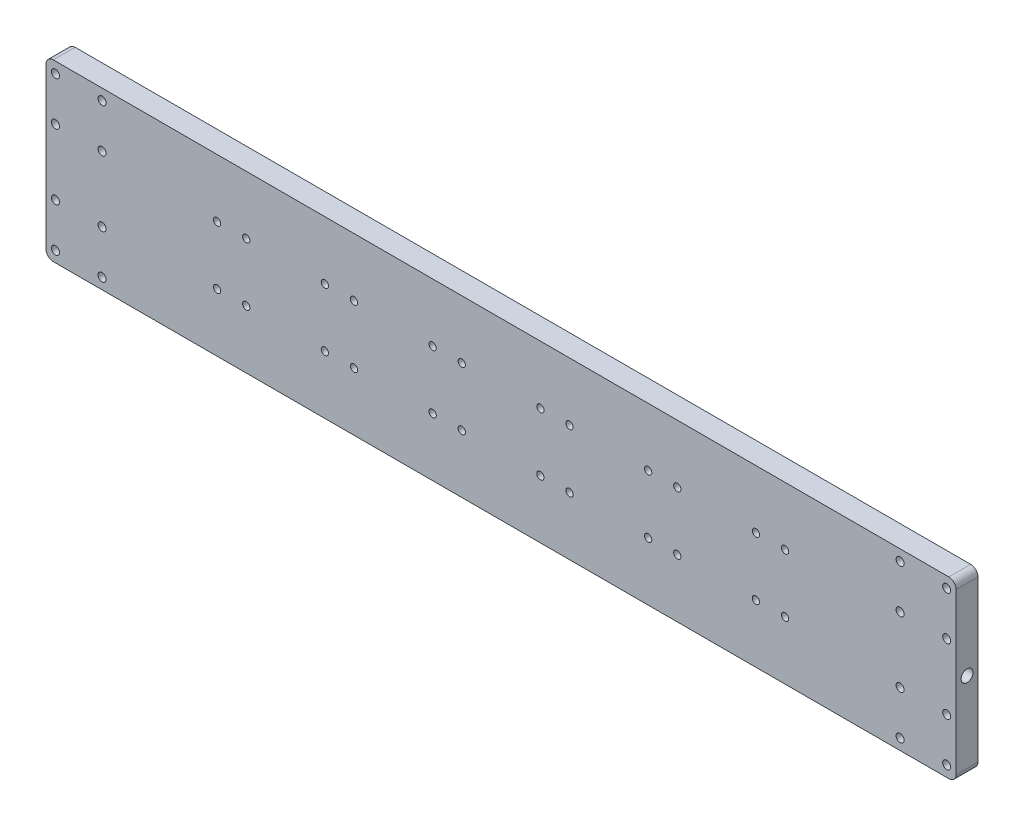
from build123d import *

# Parameters (mm, degrees)
ESQUISSE1_W                  = 625
ESQUISSE1_H                  = 120
BOSS_EXTRU_1_DEPTH           = 15
ENL_V_MAT_EXTRU_1_DEPTH      = 637.592491316
ENL_V_MAT_EXTRU_1_DEPTH_BACK = 637.592491316
ESQUISSE2_R                  = 2.75
CONG_1_R                     = 5
ESQUISSE3_R                  = 4.1
ENL_V_MAT_EXTRU_2_DEPTH      = 20
ENL_V_START                  = -605
ESQUISSE3_2_R                = 4.1
ENL_V_MAT_EXTRU_3_DEPTH      = 20
ENL_V_MAT_EXTRU_4_DEPTH      = 637.592491316
ENL_V_MAT_EXTRU_4_DEPTH_BACK = 637.592491316
ESQUISSE4_R                  = 2.5


with BuildPart() as part:
    # Esquisse1 → Boss.-Extru.1 (new body)
    with BuildSketch(Plane.XY):
        with Locations((312.5, 60)):
            Rectangle(ESQUISSE1_W, ESQUISSE1_H)
    extrude(amount=BOSS_EXTRU_1_DEPTH)

    # Esquisse2 → Enlèv. mat.-Extru.1 (cut, two sides: drawn at the far end of the back side and taken through both)
    with BuildSketch(Plane.XY.offset(15).offset(-ENL_V_MAT_EXTRU_1_DEPTH_BACK)):
        with Locations((6.5, 112.5)):
            Circle(ESQUISSE2_R)
        with Locations((6.5, 82.5)):
            Circle(ESQUISSE2_R)
        with Locations(Location((38.5, 82.5, 0), (0, 0, 180))):
            Circle(ESQUISSE2_R)
        with Locations(Location((38.5, 112.5, 0), (0, 0, 180))):
            Circle(ESQUISSE2_R)
        with Locations((38.5, 7.5)):
            Circle(ESQUISSE2_R)
        with Locations((38.5, 37.5)):
            Circle(ESQUISSE2_R)
        with Locations(Location((6.5, 37.5, 0), (0, 0, 180))):
            Circle(ESQUISSE2_R)
        with Locations(Location((6.5, 7.5, 0), (0, 0, 180))):
            Circle(ESQUISSE2_R)
        with Locations((618.5, 7.5)):
            Circle(ESQUISSE2_R)
        with Locations((618.5, 37.5)):
            Circle(ESQUISSE2_R)
        with Locations(Location((586.5, 37.5, 0), (0, 0, 180))):
            Circle(ESQUISSE2_R)
        with Locations(Location((586.5, 7.5, 0), (0, 0, 180))):
            Circle(ESQUISSE2_R)
        with Locations((586.5, 112.5)):
            Circle(ESQUISSE2_R)
        with Locations((586.5, 82.5)):
            Circle(ESQUISSE2_R)
        with Locations(Location((618.5, 82.5, 0), (0, 0, 180))):
            Circle(ESQUISSE2_R)
        with Locations(Location((618.5, 112.5, 0), (0, 0, 180))):
            Circle(ESQUISSE2_R)
    extrude(amount=ENL_V_MAT_EXTRU_1_DEPTH + ENL_V_MAT_EXTRU_1_DEPTH_BACK, mode=Mode.SUBTRACT)

    # Congé1
    cong_1_edges = [part.edges().sort_by_distance(p)[0] for p in [
        (0, 120, 7.5),
        (625, 120, 7.5),
        (625, 0, 7.5),
        (0, 0, 7.5),
    ]]
    fillet(cong_1_edges, radius=CONG_1_R)

    # Esquisse3 → Enlèv. mat.-Extru.2 (cut)
    with BuildSketch(Plane(origin=(625, 0, 0), x_dir=(0, 0, -1), z_dir=(1, 0, 0))):
        with Locations((-7.5, 60)):
            Circle(ESQUISSE3_R)
    extrude(amount=-ENL_V_MAT_EXTRU_2_DEPTH, mode=Mode.SUBTRACT)

    # Esquisse3<2> → Enlèv. mat.-Extru.3 (cut)
    with BuildSketch(Plane(origin=(625, 0, 0), x_dir=(0, 0, -1), z_dir=(1, 0, 0)).offset(ENL_V_START)):
        with Locations((-7.5, 60)):
            Circle(ESQUISSE3_2_R)
    extrude(amount=-ENL_V_MAT_EXTRU_3_DEPTH, mode=Mode.SUBTRACT)

    # Esquisse4 → Enlèv. mat.-Extru.4 (cut, two sides: drawn at the far end of the back side and taken through both)
    with BuildSketch(Plane.XY.offset(15).offset(-ENL_V_MAT_EXTRU_4_DEPTH_BACK)):
        with Locations((265.5, 80)):
            Circle(ESQUISSE4_R)
        with Locations(Location((285.5, 80, 0), (0, 0, 180))):
            Circle(ESQUISSE4_R)
        with Locations((285.5, 40)):
            Circle(ESQUISSE4_R)
        with Locations(Location((265.5, 40, 0), (0, 0, 180))):
            Circle(ESQUISSE4_R)
        with Locations((359.5, 40)):
            Circle(ESQUISSE4_R)
        with Locations(Location((339.5, 40, 0), (0, 0, 180))):
            Circle(ESQUISSE4_R)
        with Locations((339.5, 80)):
            Circle(ESQUISSE4_R)
        with Locations(Location((359.5, 80, 0), (0, 0, 180))):
            Circle(ESQUISSE4_R)
        with Locations((211.5, 40)):
            Circle(ESQUISSE4_R)
        with Locations(Location((191.5, 40, 0), (0, 0, 180))):
            Circle(ESQUISSE4_R)
        with Locations((191.5, 80)):
            Circle(ESQUISSE4_R)
        with Locations(Location((211.5, 80, 0), (0, 0, 180))):
            Circle(ESQUISSE4_R)
        with Locations((117.5, 80)):
            Circle(ESQUISSE4_R)
        with Locations(Location((137.5, 80, 0), (0, 0, 180))):
            Circle(ESQUISSE4_R)
        with Locations((137.5, 40)):
            Circle(ESQUISSE4_R)
        with Locations(Location((117.5, 40, 0), (0, 0, 180))):
            Circle(ESQUISSE4_R)
        with Locations((507.5, 40)):
            Circle(ESQUISSE4_R)
        with Locations(Location((487.5, 40, 0), (0, 0, 180))):
            Circle(ESQUISSE4_R)
        with Locations((487.5, 80)):
            Circle(ESQUISSE4_R)
        with Locations(Location((507.5, 80, 0), (0, 0, 180))):
            Circle(ESQUISSE4_R)
        with Locations((413.5, 80)):
            Circle(ESQUISSE4_R)
        with Locations(Location((433.5, 80, 0), (0, 0, 180))):
            Circle(ESQUISSE4_R)
        with Locations((433.5, 40)):
            Circle(ESQUISSE4_R)
        with Locations(Location((413.5, 40, 0), (0, 0, 180))):
            Circle(ESQUISSE4_R)
    extrude(amount=ENL_V_MAT_EXTRU_4_DEPTH + ENL_V_MAT_EXTRU_4_DEPTH_BACK, mode=Mode.SUBTRACT)


solid = part.part
